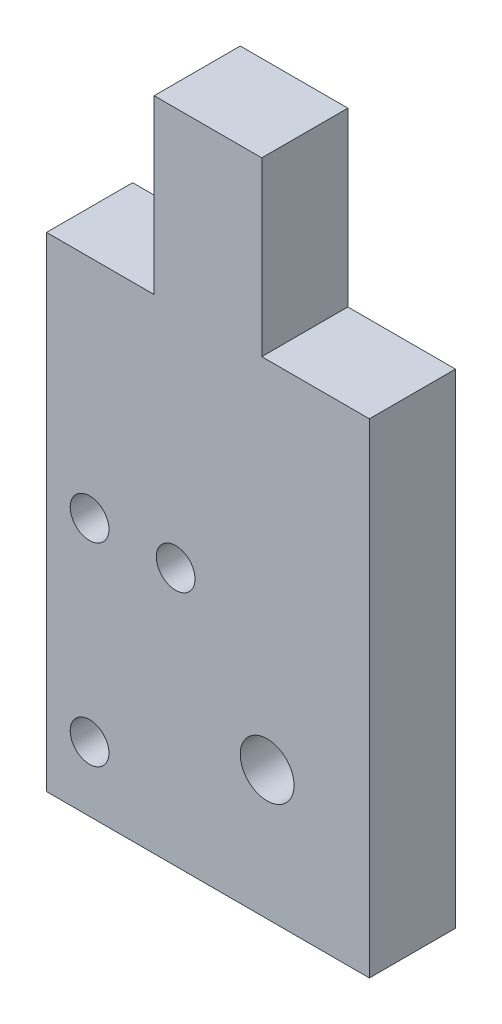
from build123d import *

# Parameters (mm, degrees)
SKETCH1_R           = 2.286
SKETCH1_R_2         = 3.175
BOSS_EXTRUDE1_DEPTH = 10.16


with BuildPart() as part:
    # Sketch1 → Boss-Extrude1 (new body)
    with BuildSketch(Plane.XY):
        Polygon((0, 57.15), (12.7, 57.15), (12.7, 77.47), (25.4, 77.47), (25.4, 57.15), (38.1, 57.15), (38.1, 0), (0, 0), align=None)
        with Locations((5.08, 7.62)):
            Circle(SKETCH1_R, mode=Mode.SUBTRACT)
        with Locations((5.08, 30.48)):
            Circle(SKETCH1_R, mode=Mode.SUBTRACT)
        with Locations((26.035, 15.24)):
            Circle(SKETCH1_R_2, mode=Mode.SUBTRACT)
        with Locations((15.24, 30.48)):
            Circle(SKETCH1_R, mode=Mode.SUBTRACT)
    extrude(amount=BOSS_EXTRUDE1_DEPTH)


solid = part.part
